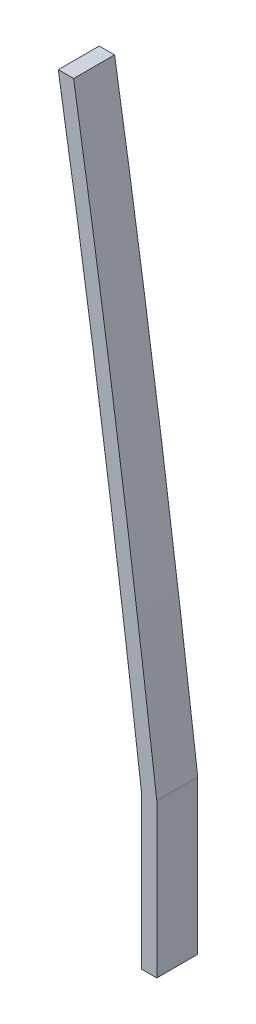
from build123d import *

# Parameters (mm, degrees)
BOSS_EXTRUDE1_DEPTH      = 6.35
BOSS_EXTRUDE1_DEPTH_BACK = 6.35


with BuildPart() as part:
    # Sketch3 → Boss-Extrude1 (new, two sides: drawn at the far end of the back side and taken through both)
    with BuildSketch(Plane.XY.offset(-BOSS_EXTRUDE1_DEPTH_BACK)):
        with BuildLine():
            Line((25.930295497, 228.6), (30.692795497, 228.6))
            add(Edge.make_bspline(
                [(30.692795497, 228.6), (32.656671965, 216.59798975), (34.557493546, 204.585654572), (41.339553497, 160.498217254), (45.907919412, 128.375397263), (52.344898005, 80.136373161), (54.419889898, 64.046285851), (56.441032457, 47.840855492), (56.454490883, 47.732922744), (56.467945104, 47.625)],
                knots=[0.158181503, 0.158181503, 0.158181503, 0.158181503, 0.194666408, 0.194666408, 0.291999611, 0.291999611, 0.340666213, 0.340666213, 0.340992559, 0.340992559, 0.340992559, 0.340992559], degree=3))
            Line((56.467945104, 47.625), (56.467945104, 0))
            Line((56.467945104, 0), (51.705445104, 0))
            Line((51.705445104, 0), (51.705445104, 47.625))
            add(Edge.make_bspline(
                [(25.930295497, 228.6), (28.835110587, 210.988612906), (34.358497112, 175.720617461), (40.71056634, 131.542229957), (45.5050338, 96.160367974), (48.389330035, 74.025463782), (50.34888675, 58.533876957), (51.261329801, 51.213221833), (51.621113082, 48.307200473), (51.705445104, 47.625)],
                knots=[0.158553364, 0.158553364, 0.158553364, 0.158553364, 0.216147542, 0.273741721, 0.30253881, 0.3313359, 0.345734444, 0.352933717, 0.355143131, 0.355143131, 0.355143131, 0.355143131], degree=3))
        make_face()
    extrude(amount=BOSS_EXTRUDE1_DEPTH + BOSS_EXTRUDE1_DEPTH_BACK)


solid = part.part
